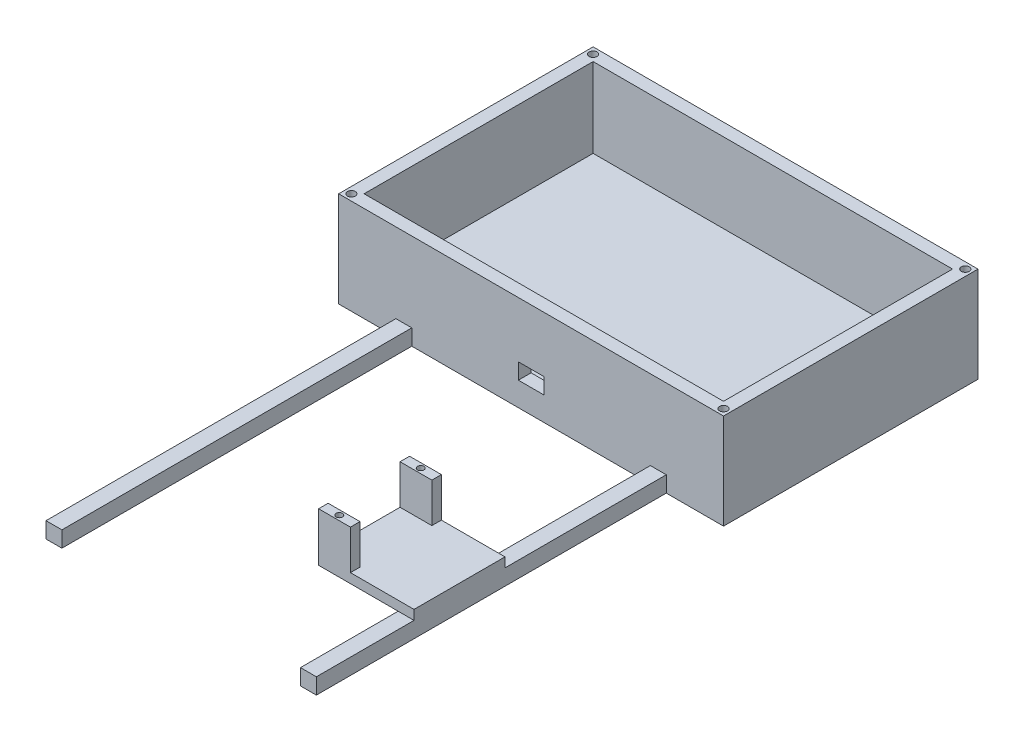
from build123d import *

# Parameters (mm, degrees)
BOSS_EXTRUDE1_DEPTH = 5
SKETCH2_W           = 113
SKETCH2_H           = 72
BOSS_EXTRUDE2_DEPTH = 25
SKETCH3_R           = 1.25
CUT_EXTRUDE1_DEPTH  = 6
SKETCH4_W           = 30
SKETCH4_H           = 28.6
BOSS_EXTRUDE3_DEPTH = 3
SKETCH5_W           = 10
SKETCH5_H           = 3
BOSS_EXTRUDE4_DEPTH = 12.4
SKETCH6_R           = 1
CUT_EXTRUDE2_DEPTH  = 4
SKETCH12_W          = 8
SKETCH12_H          = 5
CUT_EXTRUDE3_DEPTH  = 21


with BuildPart() as part:
    # Sketch1 → Boss-Extrude1 (new body)
    with BuildSketch(Plane(origin=(0, 0, 0), x_dir=(1, 0, 0), z_dir=(0, 1, 0))):
        Polygon((-42.5, -81), (-42.5, 29), (-60.5, 29), (-60.5, 109), (60.5, 109), (60.5, 29), (42.5, 29), (42.5, -81), (37.5, -81), (37.5, 29), (-37.5, 29), (-37.5, -81), align=None)
    extrude(amount=BOSS_EXTRUDE1_DEPTH)

    # Sketch2 → Boss-Extrude2 (add)
    with BuildSketch(Plane(origin=(0, 5, 0), x_dir=(1, 0, 0), z_dir=(0, 1, 0))):
        Polygon((-60.5, 109), (-60.5, 29), (-42.5, 29), (-37.5, 29), (37.5, 29), (42.5, 29), (60.5, 29), (60.5, 109), align=None)
        with Locations((0, 69)):
            Rectangle(SKETCH2_W, SKETCH2_H, mode=Mode.SUBTRACT)
    extrude(amount=BOSS_EXTRUDE2_DEPTH)

    # Sketch3 → Cut-Extrude1 (cut)
    with BuildSketch(Plane(origin=(0, 30, 0), x_dir=(1, 0, 0), z_dir=(0, 1, 0))):
        with Locations(Location((-58.5, 31, 0), (0, 0, 270))):
            Circle(SKETCH3_R)
        with Locations(Location((58.5, 31, 0), (0, 0, 90))):
            Circle(SKETCH3_R)
        with Locations(Location((-58.5, 107, 0), (0, 0, 90))):
            Circle(SKETCH3_R)
        with Locations(Location((58.5, 107, 0), (0, 0, 270))):
            Circle(SKETCH3_R)
    extrude(amount=-CUT_EXTRUDE1_DEPTH, mode=Mode.SUBTRACT)

    # Sketch4 → Boss-Extrude3 (add)
    with BuildSketch(Plane(origin=(0, 5, 0), x_dir=(1, 0, 0), z_dir=(0, 1, 0))):
        with Locations((27.5, -36)):
            Rectangle(SKETCH4_W, SKETCH4_H)
    extrude(amount=BOSS_EXTRUDE3_DEPTH)

    # Sketch5 → Boss-Extrude4 (add)
    with BuildSketch(Plane(origin=(0, 8, 0), x_dir=(1, 0, 0), z_dir=(0, 1, 0))):
        with Locations((17.5, -23.2)):
            Rectangle(SKETCH5_W, SKETCH5_H)
        with Locations((17.5, -48.8)):
            Rectangle(SKETCH5_W, SKETCH5_H)
    extrude(amount=BOSS_EXTRUDE4_DEPTH)

    # Sketch6 → Cut-Extrude2 (cut)
    with BuildSketch(Plane(origin=(0, 20.4, 0), x_dir=(1, 0, 0), z_dir=(0, 1, 0))):
        with Locations(Location((17.5, -48.8, 0), (0, 0, 270))):
            Circle(SKETCH6_R)
        with Locations(Location((17.5, -23.2, 0), (0, 0, 270))):
            Circle(SKETCH6_R)
    extrude(amount=-CUT_EXTRUDE2_DEPTH, mode=Mode.SUBTRACT)

    # Sketch12 → Cut-Extrude3 (cut)
    with BuildSketch(Plane.XY.offset(-29)):
        with Locations((0, 10)):
            Rectangle(SKETCH12_W, SKETCH12_H)
    extrude(amount=-CUT_EXTRUDE3_DEPTH, mode=Mode.SUBTRACT)


solid = part.part
